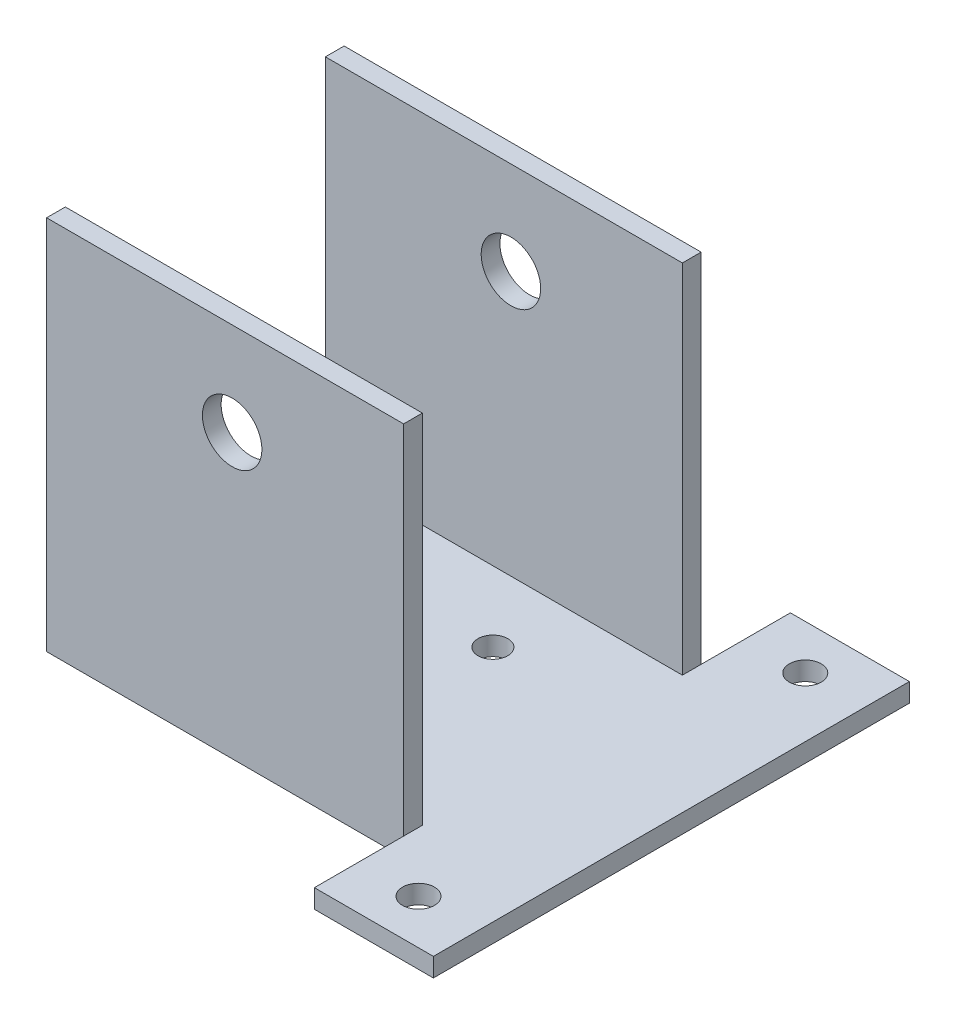
from build123d import *

# Parameters (mm, degrees)
SKETCH1_R           = 1.7
SKETCH1_R_2         = 1.5875
BOSS_EXTRUDE1_DEPTH = 2
SKETCH2_W           = 38.1
SKETCH2_H           = 2
BOSS_EXTRUDE2_DEPTH = 38.1
SKETCH3_R           = 3.175
CUT_EXTRUDE1_DEPTH  = 63.903065307


with BuildPart() as part:
    # Sketch1 → Boss-Extrude1 (new body)
    with BuildSketch(Plane(origin=(0, 0, 0), x_dir=(1, 0, 0), z_dir=(0, 1, 0))):
        Polygon((-25.4, 15.875), (12.7, 15.875), (12.7, 25.4), (25.4, 25.4), (25.4, -25.4), (12.7, -25.4), (12.7, -15.875), (-25.4, -15.875), align=None)
        with Locations(Location((19.05, 20.6375, 0), (0, 0, 270))):
            Circle(SKETCH1_R, mode=Mode.SUBTRACT)
        with Locations(Location((19.05, -20.6375, 0), (0, 0, 270))):
            Circle(SKETCH1_R, mode=Mode.SUBTRACT)
        with Locations(Location((0, 6.35, 0), (0, 0, 270))):
            Circle(SKETCH1_R_2, mode=Mode.SUBTRACT)
        with Locations(Location((0, -6.35, 0), (0, 0, 270))):
            Circle(SKETCH1_R_2, mode=Mode.SUBTRACT)
    extrude(amount=BOSS_EXTRUDE1_DEPTH)

    # Sketch2 → Boss-Extrude2 (add)
    with BuildSketch(Plane(origin=(0, 2, 0), x_dir=(1, 0, 0), z_dir=(0, 1, 0))):
        with Locations((-6.35, 14.875)):
            Rectangle(SKETCH2_W, SKETCH2_H)
        with Locations((-6.35, -14.875)):
            Rectangle(SKETCH2_W, SKETCH2_H)
    extrude(amount=BOSS_EXTRUDE2_DEPTH)

    # Sketch3 → Cut-Extrude1 (cut, through all)
    with BuildSketch(Plane.XY.offset(15.875)):
        with Locations((-5.6, 30.16795818)):
            Circle(SKETCH3_R)
    extrude(amount=-CUT_EXTRUDE1_DEPTH, mode=Mode.SUBTRACT)


solid = part.part
